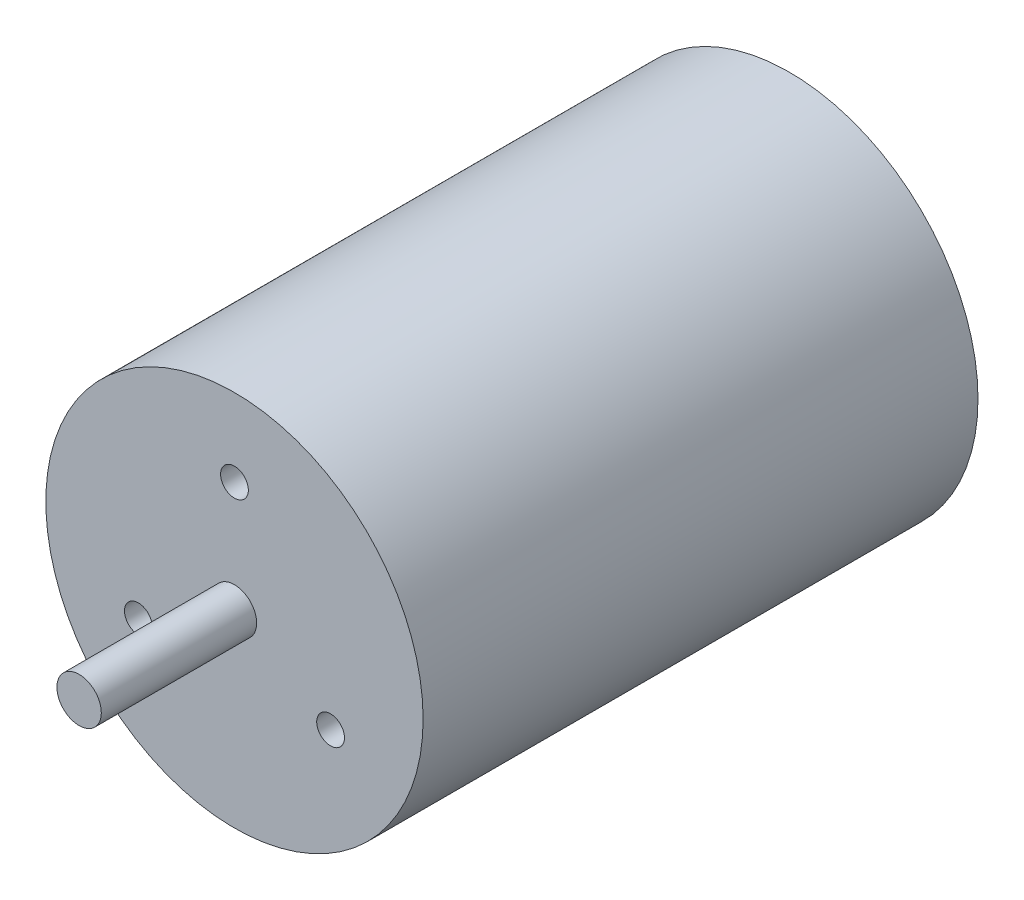
from build123d import *

# Parameters (mm, degrees)
SKETCH1_R                 = 34
BOSS_EXTRUDE1_DEPTH       = 100
SKETCH3_R                 = 4
BOSS_EXTRUDE2_DEPTH       = 28
M6X1_0_TAPPED_HOLE1_D     = 5
M6X1_0_TAPPED_HOLE1_DEPTH = 14.9987
M6X1_0_TAPPED_HOLE1_TIP   = 1.502151548
SKETCH6_R                 = 15
BOSS_EXTRUDE3_DEPTH       = 8


with BuildPart() as part:
    # Sketch1 → Boss-Extrude1 (new body)
    with BuildSketch(Plane.XY):
        Circle(SKETCH1_R)
    extrude(amount=BOSS_EXTRUDE1_DEPTH)

    # Sketch3 → Boss-Extrude2 (add)
    with BuildSketch(Plane.XY.offset(100)):
        Circle(SKETCH3_R)
    extrude(amount=BOSS_EXTRUDE2_DEPTH)

    # M6x1.0 Tapped Hole1
    with Locations(Plane(origin=(0, 20, 100), x_dir=(1, 0, 0), z_dir=(0, 0, 1))):
        with Locations((0, 0), (17.320508076, -30), (-17.320508076, -30)):
            Hole(M6X1_0_TAPPED_HOLE1_D / 2, depth=M6X1_0_TAPPED_HOLE1_DEPTH)
            with Locations((0, 0, -(M6X1_0_TAPPED_HOLE1_DEPTH + M6X1_0_TAPPED_HOLE1_TIP / 2))):  # 118° drill point
                Cone(0, M6X1_0_TAPPED_HOLE1_D / 2, M6X1_0_TAPPED_HOLE1_TIP, mode=Mode.SUBTRACT)

    # Sketch6 → Boss-Extrude3 (add)
    with BuildSketch(Plane(origin=(0, 0, 0), x_dir=(-1, 0, 0), z_dir=(0, 0, -1))):
        with Locations(Location((0, 0, 0), (0, 0, 180))):
            Circle(SKETCH6_R)
    extrude(amount=BOSS_EXTRUDE3_DEPTH)


solid = part.part
